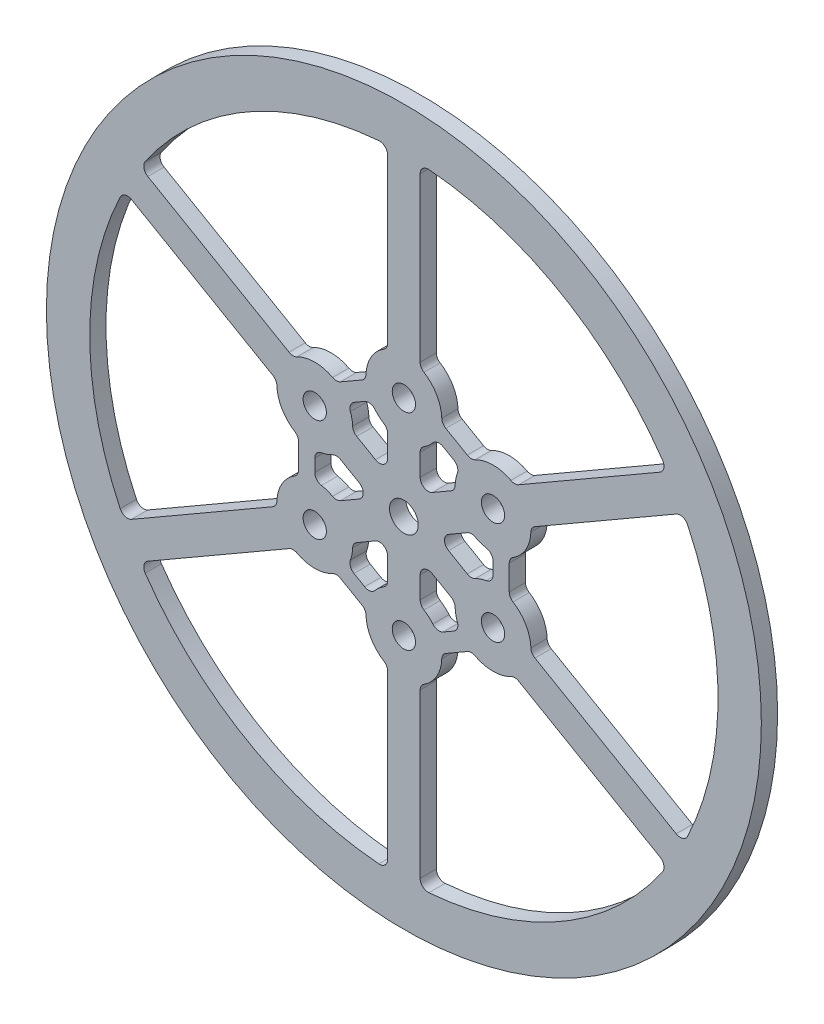
from build123d import *

# Parameters (mm, degrees)
SKETCH_1_R          = 66
EXTRUDE_1_DEPTH     = 1.5
HOLE_WIZARD_M4_1_D  = 4.3
HOLE_WIZARD_M5_1_D  = 5.3
CUT_EXTRUDE_1_DEPTH = 94.386294498
FILLET_1_R          = 1.5


with BuildPart() as part:
    # ｽｹｯﾁ1 → ﾎﾞｽ - 押し出し1 (new, symmetric)
    with BuildSketch(Plane.XY):
        Circle(SKETCH_1_R)
    extrude(amount=EXTRUDE_1_DEPTH, both=True)

    # M4 すきま穴1 (through all)
    with Locations(Plane(origin=(0, 19, -1.5), x_dir=(-1, 0, 0), z_dir=(0, 0, -1))):
        with Locations((0, 0), (-16.454482672, -9.5), (-16.454482672, -28.5), (0, -38), (16.454482672, -28.5), (16.454482672, -9.5)):
            Hole(HOLE_WIZARD_M4_1_D / 2)

    # M5 すきま穴1 (through all)
    with Locations(Plane.XY.offset(1.5)):
        with Locations((0, 0)):
            Hole(HOLE_WIZARD_M5_1_D / 2)

    # ｽｹｯﾁ4 → ｶｯﾄ - 押し出し1 (cut, through all)
    with BuildSketch(Plane.XY.offset(1.5)):
        with BuildLine():
            ThreePointArc((-6.977225575, 18.435798551), (-6.062177826, 22.5), (-3, 25.32455532))
            Line((-3, 25.32455532), (-3, 57.92236183))
            ThreePointArc((-3, 57.92236183), (-29, 50.229473419), (-48.662236792, 31.559257127))
            Line((-48.662236792, 31.559257127), (-20.431708247, 15.260353872))
            ThreePointArc((-20.431708247, 15.260353872), (-16.454482672, 16.5), (-12.477257097, 15.260353872))
            Line((-12.477257097, 15.260353872), (-6.977225575, 18.435798551))
        make_face()
        with BuildLine():
            Line((-23.431708247, 10.064201449), (-51.662236792, 26.363104704))
            ThreePointArc((-51.662236792, 26.363104704), (-58, 0), (-51.662236792, -26.363104704))
            Line((-51.662236792, -26.363104704), (-23.431708247, -10.064201449))
            ThreePointArc((-23.431708247, -10.064201449), (-22.516660498, -6), (-19.454482672, -3.17544468))
            Line((-19.454482672, -3.17544468), (-19.454482672, 3.17544468))
            ThreePointArc((-19.454482672, 3.17544468), (-22.516660498, 6), (-23.431708247, 10.064201449))
        make_face()
        with BuildLine():
            ThreePointArc((-7.922616289, -1.110023032), (-8, 0), (-7.922616289, 1.110023032))
            Line((-7.922616289, 1.110023032), (-12.477257097, 3.739646128))
            ThreePointArc((-12.477257097, 3.739646128), (-14.371035944, 2.817242356), (-16.453482672, 2.500000071))
            Line((-16.453482672, 2.500000071), (-16.453482672, -2.500000071))
            ThreePointArc((-16.453482672, -2.500000071), (-14.371035944, -2.817242356), (-12.477257097, -3.739646128))
            Line((-12.477257097, -3.739646128), (-7.922616289, -1.110023032))
        make_face()
        with BuildLine():
            Line((-3, 7.416198487), (-3, 12.67544468))
            ThreePointArc((-3, 12.67544468), (-4.745714523, 13.854303384), (-6.061677765, 15.49913401))
            Line((-6.061677765, 15.49913401), (-10.391804907, 12.999133939))
            ThreePointArc((-10.391804907, 12.999133939), (-9.692872496, 11.311250348), (-9.454482672, 9.5))
            ThreePointArc((-9.454482672, 9.5), (-9.460178596, 9.217669542), (-9.477257097, 8.935798551))
            Line((-9.477257097, 8.935798551), (-4.922616289, 6.306175455))
            ThreePointArc((-4.922616289, 6.306175455), (-4, 6.92820323), (-3, 7.416198487))
        make_face()
        with BuildLine():
            Line((10.391804907, 12.999133939), (6.061677765, 15.49913401))
            ThreePointArc((6.061677765, 15.49913401), (4.745714523, 13.854303384), (3, 12.67544468))
            Line((3, 12.67544468), (3, 7.416198487))
            ThreePointArc((3, 7.416198487), (4, 6.92820323), (4.922616289, 6.306175455))
            Line((4.922616289, 6.306175455), (9.477257097, 8.935798551))
            ThreePointArc((9.477257097, 8.935798551), (9.625321421, 11.037061028), (10.391804907, 12.999133939))
        make_face()
        with BuildLine():
            ThreePointArc((16.453482672, 2.500000071), (14.371035944, 2.817242356), (12.477257097, 3.739646128))
            Line((12.477257097, 3.739646128), (7.922616289, 1.110023032))
            ThreePointArc((7.922616289, 1.110023032), (7.980630624, 0.556358556), (8, 0))
            ThreePointArc((8, 0), (7.980630624, -0.556358556), (7.922616289, -1.110023032))
            Line((7.922616289, -1.110023032), (12.477257097, -3.739646128))
            ThreePointArc((12.477257097, -3.739646128), (14.371035944, -2.817242356), (16.453482672, -2.500000071))
            Line((16.453482672, -2.500000071), (16.453482672, 2.500000071))
        make_face()
        with BuildLine():
            Line((9.477257097, -8.935798551), (4.922616289, -6.306175455))
            ThreePointArc((4.922616289, -6.306175455), (4, -6.92820323), (3, -7.416198487))
            Line((3, -7.416198487), (3, -12.67544468))
            ThreePointArc((3, -12.67544468), (4.745714523, -13.854303384), (6.061677765, -15.49913401))
            Line((6.061677765, -15.49913401), (10.391804907, -12.999133939))
            ThreePointArc((10.391804907, -12.999133939), (9.625321421, -11.037061028), (9.477257097, -8.935798551))
        make_face()
        with BuildLine():
            ThreePointArc((-3, -7.416198487), (-4, -6.92820323), (-4.922616289, -6.306175455))
            Line((-4.922616289, -6.306175455), (-9.477257097, -8.935798551))
            ThreePointArc((-9.477257097, -8.935798551), (-9.460178596, -9.217669542), (-9.454482672, -9.5))
            ThreePointArc((-9.454482672, -9.5), (-9.692872496, -11.311250348), (-10.391804907, -12.999133939))
            Line((-10.391804907, -12.999133939), (-6.061677765, -15.49913401))
            ThreePointArc((-6.061677765, -15.49913401), (-4.745714523, -13.854303384), (-3, -12.67544468))
            Line((-3, -12.67544468), (-3, -7.416198487))
        make_face()
        with BuildLine():
            Line((-3, -7.416198487), (-3, -5.196152423))
            Line((-3, -5.196152423), (-4.922616289, -6.306175455))
            ThreePointArc((-4.922616289, -6.306175455), (-4, -6.92820323), (-3, -7.416198487))
        make_face()
        with BuildLine():
            Line((-6, 0), (-7.922616289, 1.110023032))
            ThreePointArc((-7.922616289, 1.110023032), (-8, 0), (-7.922616289, -1.110023032))
            Line((-7.922616289, -1.110023032), (-6, 0))
        make_face()
        with BuildLine():
            Line((-3, 5.196152423), (-3, 7.416198487))
            ThreePointArc((-3, 7.416198487), (-4, 6.92820323), (-4.922616289, 6.306175455))
            Line((-4.922616289, 6.306175455), (-3, 5.196152423))
        make_face()
        with BuildLine():
            ThreePointArc((4.922616289, 6.306175455), (4, 6.92820323), (3, 7.416198487))
            Line((3, 7.416198487), (3, 5.196152423))
            Line((3, 5.196152423), (4.922616289, 6.306175455))
        make_face()
        with BuildLine():
            ThreePointArc((8, 0), (7.980630624, 0.556358556), (7.922616289, 1.110023032))
            Line((7.922616289, 1.110023032), (6, 0))
            Line((6, 0), (7.922616289, -1.110023032))
            ThreePointArc((7.922616289, -1.110023032), (7.980630624, -0.556358556), (8, 0))
        make_face()
        with BuildLine():
            Line((4.922616289, -6.306175455), (3, -5.196152423))
            Line((3, -5.196152423), (3, -7.416198487))
            ThreePointArc((3, -7.416198487), (4, -6.92820323), (4.922616289, -6.306175455))
        make_face()
        with BuildLine():
            Line((-20.431708247, -15.260353872), (-48.662236792, -31.559257127))
            ThreePointArc((-48.662236792, -31.559257127), (-29, -50.229473419), (-3, -57.92236183))
            Line((-3, -57.92236183), (-3, -25.32455532))
            ThreePointArc((-3, -25.32455532), (-6.062177826, -22.5), (-6.977225575, -18.435798551))
            Line((-6.977225575, -18.435798551), (-12.477257097, -15.260353872))
            ThreePointArc((-12.477257097, -15.260353872), (-16.454482672, -16.5), (-20.431708247, -15.260353872))
        make_face()
        with BuildLine():
            ThreePointArc((3, -57.92236183), (29, -50.229473419), (48.662236792, -31.559257127))
            Line((48.662236792, -31.559257127), (20.431708247, -15.260353872))
            ThreePointArc((20.431708247, -15.260353872), (16.454482672, -16.5), (12.477257097, -15.260353872))
            Line((12.477257097, -15.260353872), (6.977225575, -18.435798551))
            ThreePointArc((6.977225575, -18.435798551), (6.994304076, -18.717669542), (7, -19))
            ThreePointArc((7, -19), (5.916079783, -22.741657387), (3, -25.32455532))
            Line((3, -25.32455532), (3, -57.92236183))
        make_face()
        with BuildLine():
            ThreePointArc((58, 0), (56.393305161, 13.557106366), (51.662236792, 26.363104704))
            Line((51.662236792, 26.363104704), (23.431708247, 10.064201449))
            ThreePointArc((23.431708247, 10.064201449), (23.448786748, 9.782330458), (23.454482672, 9.5))
            ThreePointArc((23.454482672, 9.5), (22.370562455, 5.758342613), (19.454482672, 3.17544468))
            Line((19.454482672, 3.17544468), (19.454482672, -3.17544468))
            ThreePointArc((19.454482672, -3.17544468), (22.370562455, -5.758342613), (23.454482672, -9.5))
            ThreePointArc((23.454482672, -9.5), (23.448786748, -9.782330458), (23.431708247, -10.064201449))
            Line((23.431708247, -10.064201449), (51.662236792, -26.363104704))
            ThreePointArc((51.662236792, -26.363104704), (56.393305161, -13.557106366), (58, 0))
        make_face()
        with BuildLine():
            Line((3, 57.92236183), (3, 25.32455532))
            ThreePointArc((3, 25.32455532), (5.916079783, 22.741657387), (7, 19))
            ThreePointArc((7, 19), (6.994304076, 18.717669542), (6.977225575, 18.435798551))
            Line((6.977225575, 18.435798551), (12.477257097, 15.260353872))
            ThreePointArc((12.477257097, 15.260353872), (16.454482672, 16.5), (20.431708247, 15.260353872))
            Line((20.431708247, 15.260353872), (48.662236792, 31.559257127))
            ThreePointArc((48.662236792, 31.559257127), (29, 50.229473419), (3, 57.92236183))
        make_face()
    extrude(amount=-CUT_EXTRUDE_1_DEPTH, mode=Mode.SUBTRACT)

    # ﾌｨﾚｯﾄ1
    fillet_1_edges = [part.edges().sort_by_distance(p)[0] for p in [
        (-20.431708247, -15.260353872, 0),
        (-12.477257097, -15.260353872, 0),
        (-6.977225575, -18.435798551, 0),
        (-3, -25.32455532, 0),
        (-3, -57.92236183, 0),
        (-48.662236792, -31.559257127, 0),
        (3, -5.196152423, 0),
        (9.477257097, -8.935798551, 0),
        (10.391804907, -12.999133939, 0),
        (6.061677765, -15.49913401, 0),
        (3, -12.67544468, 0),
        (6, 0, 0),
        (12.477257097, 3.739646128, 0),
        (16.453482672, 2.500000071, 0),
        (16.453482672, -2.500000071, 0),
        (12.477257097, -3.739646128, 0),
        (3, 5.196152423, 0),
        (3, 12.67544468, 0),
        (6.061677765, 15.49913401, 0),
        (10.391804907, 12.999133939, 0),
        (9.477257097, 8.935798551, 0),
        (-23.431708247, 10.064201449, 0),
        (-19.454482672, 3.17544468, 0),
        (-19.454482672, -3.17544468, 0),
        (-23.431708247, -10.064201449, 0),
        (-51.662236792, -26.363104704, 0),
        (-51.662236792, 26.363104704, 0),
        (-3, -5.196152423, 0),
        (-3, -12.67544468, 0),
        (-6.061677765, -15.49913401, 0),
        (-10.391804907, -12.999133939, 0),
        (-9.477257097, -8.935798551, 0),
        (-6, 0, 0),
        (-12.477257097, -3.739646128, 0),
        (-16.453482672, -2.500000071, 0),
        (-16.453482672, 2.500000071, 0),
        (-12.477257097, 3.739646128, 0),
        (-3, 5.196152423, 0),
        (-9.477257097, 8.935798551, 0),
        (-10.391804907, 12.999133939, 0),
        (-6.061677765, 15.49913401, 0),
        (-3, 12.67544468, 0),
        (20.431708247, 15.260353872, 0),
        (12.477257097, 15.260353872, 0),
        (6.977225575, 18.435798551, 0),
        (3, 25.32455532, 0),
        (3, 57.92236183, 0),
        (48.662236792, 31.559257127, 0),
        (3, -25.32455532, 0),
        (6.977225575, -18.435798551, 0),
        (12.477257097, -15.260353872, 0),
        (20.431708247, -15.260353872, 0),
        (48.662236792, -31.559257127, 0),
        (3, -57.92236183, 0),
        (23.431708247, -10.064201449, 0),
        (19.454482672, -3.17544468, 0),
        (19.454482672, 3.17544468, 0),
        (23.431708247, 10.064201449, 0),
        (51.662236792, 26.363104704, 0),
        (51.662236792, -26.363104704, 0),
        (-12.477257097, 15.260353872, 0),
        (-20.431708247, 15.260353872, 0),
        (-48.662236792, 31.559257127, 0),
        (-3, 57.92236183, 0),
        (-3, 25.32455532, 0),
        (-6.977225575, 18.435798551, 0),
    ]]
    fillet(fillet_1_edges, radius=FILLET_1_R)


solid = part.part
